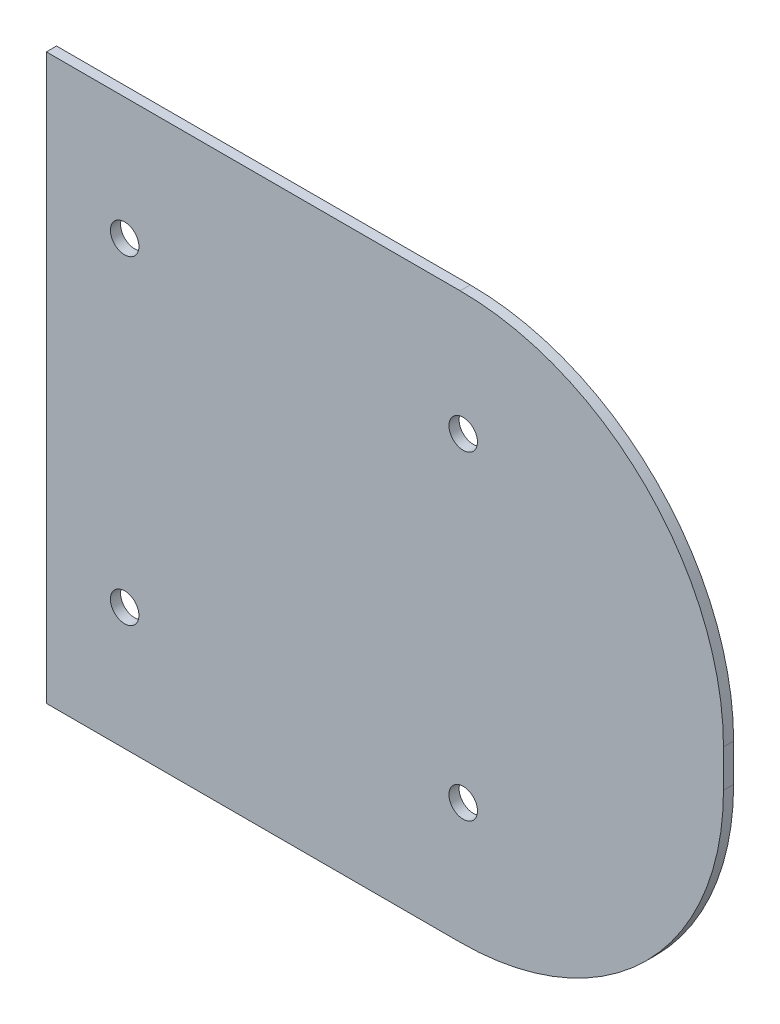
from build123d import *

# Parameters (mm, degrees)
Y_KSEKLIK_EKSTR_ZYON3_DEPTH = 2.7
IZIM2_R                     = 3.79
KES_EKSTR_ZYON1_DEPTH       = 2.75


with BuildPart() as part:
    # Çizim1 → Yükseklik-Ekstrüzyon3 (new body)
    with BuildSketch(Plane.XY):
        with BuildLine():
            Line((-90, -75), (20, -75))
            ThreePointArc((20, -75), (69.497474683, -54.497474683), (90, -5))
            Line((90, -5), (90, 5))
            ThreePointArc((90, 5), (69.497474683, 54.497474683), (20, 75))
            Line((20, 75), (-90, 75))
            Line((-90, 75), (-90, -75))
        make_face()
    extrude(amount=Y_KSEKLIK_EKSTR_ZYON3_DEPTH)

    # Çizim2 → Kes-Ekstrüzyon1 (cut)
    with BuildSketch(Plane.XY.offset(2.7)):
        with Locations((-69.187191481, 42.468560625)):
            Circle(IZIM2_R)
        with Locations((20.812808519, 42.468560625)):
            Circle(IZIM2_R)
        with Locations(Location((20.812808519, -42.468560625, 0), (0, 0, 180))):
            Circle(IZIM2_R)
        with Locations(Location((-69.187191481, -42.468560625, 0), (0, 0, 180))):
            Circle(IZIM2_R)
    extrude(amount=-KES_EKSTR_ZYON1_DEPTH, mode=Mode.SUBTRACT)


solid = part.part
